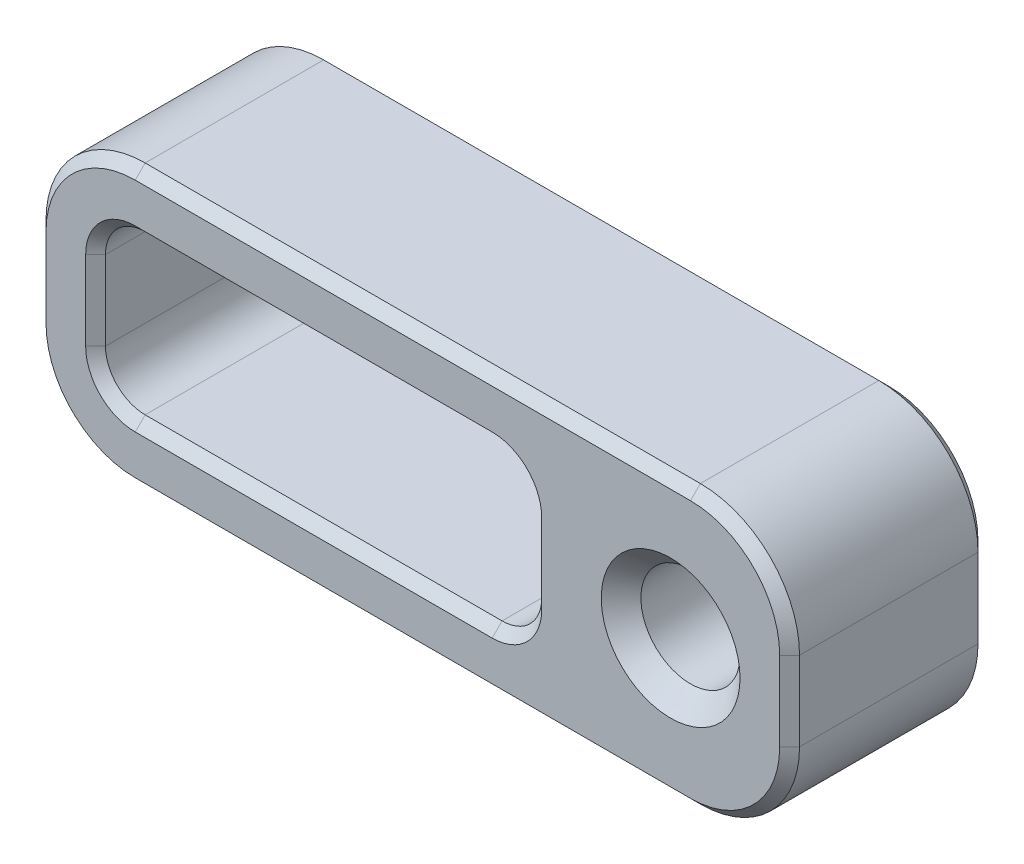
from build123d import *

# Parameters (mm, degrees)
SKETCH1_R           = 2.5
BOSS_EXTRUDE1_DEPTH = 10
CHAMFER1_SIZE       = 1
CHAMFER2_SIZE       = 0.5


with BuildPart() as part:
    # Sketch1 → Boss-Extrude1 (new body)
    # profile 1 of 2: a face of its own
    with BuildSketch(Plane(origin=(0, 0, 0), x_dir=(0, 1, 0), z_dir=(0, 0, 1))):
        with BuildLine():
            ThreePointArc((-3, 20), (-1.535533906, 23.535533906), (2, 25))
            Line((2, 25), (6, 25))
            ThreePointArc((6, 25), (9.535533906, 23.535533906), (11, 20))
            Line((11, 20), (11, 2))
            ThreePointArc((11, 2), (9.535533906, -1.535533906), (6, -3))
            Line((6, -3), (2, -3))
            ThreePointArc((2, -3), (-1.535533906, -1.535533906), (-3, 2))
            Line((-3, 2), (-3, 20))
        make_face()
        with BuildLine():
            Line((2, 22), (6, 22))
            ThreePointArc((6, 22), (7.414213562, 21.414213562), (8, 20))
            Line((8, 20), (8, 2))
            ThreePointArc((8, 2), (7.414213562, 0.585786438), (6, 0))
            Line((6, 0), (2, 0))
            ThreePointArc((2, 0), (0.585786438, 0.585786438), (0, 2))
            Line((0, 2), (0, 20))
            ThreePointArc((0, 20), (0.585786438, 21.414213562), (2, 22))
        make_face(mode=Mode.SUBTRACT)
    # profile 2 of 2: a face of its own
    with BuildSketch(Plane(origin=(0, 0, 0), x_dir=(0, 1, 0), z_dir=(0, 0, 1))):
        with BuildLine():
            Line((2, -13), (6, -13))
            ThreePointArc((6, -13), (9.535533906, -11.535533906), (11, -8))
            Line((11, -8), (11, 2))
            ThreePointArc((11, 2), (9.535533906, -1.535533906), (6, -3))
            Line((6, -3), (2, -3))
            ThreePointArc((2, -3), (-1.535533906, -1.535533906), (-3, 2))
            Line((-3, 2), (-3, -8))
            ThreePointArc((-3, -8), (-1.535533906, -11.535533906), (2, -13))
        make_face()
        with Locations(Location((4, -7, 0), (0, 0, 270))):
            Circle(SKETCH1_R, mode=Mode.SUBTRACT)
    extrude(amount=BOSS_EXTRUDE1_DEPTH)

    # Chamfer1
    chamfer1_edges = [part.edges().sort_by_distance(p)[0] for p in [
        (4.5, 4, 0),
        (4.5, 4, 10),
    ]]
    chamfer(chamfer1_edges, length=CHAMFER1_SIZE)

    # Chamfer2
    chamfer2_edges = [part.edges().sort_by_distance(p)[0] for p in [
        (11.535533906, -1.535533906, 10),
        (13, 4, 10),
        (-21.414213562, 0.585786438, 0),
        (-11, 0, 0),
        (-0.585786438, 0.585786438, 0),
        (0, 4, 0),
        (-0.585786438, 7.414213562, 0),
        (-11, 8, 0),
        (-21.414213562, 7.414213562, 0),
        (-22, 4, 0),
        (11.535533906, 9.535533906, 10),
        (-23.535533906, -1.535533906, 0),
        (-25, 4, 0),
        (-23.535533906, 9.535533906, 0),
        (-6, 11, 0),
        (11.535533906, 9.535533906, 0),
        (13, 4, 0),
        (11.535533906, -1.535533906, 0),
        (-6, -3, 0),
        (-6, 11, 10),
        (-23.535533906, 9.535533906, 10),
        (-25, 4, 10),
        (-23.535533906, -1.535533906, 10),
        (-22, 4, 10),
        (-21.414213562, 7.414213562, 10),
        (-11, 8, 10),
        (-0.585786438, 7.414213562, 10),
        (-6, -3, 10),
        (0, 4, 10),
        (-0.585786438, 0.585786438, 10),
        (-11, 0, 10),
        (-21.414213562, 0.585786438, 10),
    ]]
    chamfer(chamfer2_edges, length=CHAMFER2_SIZE)


solid = part.part
